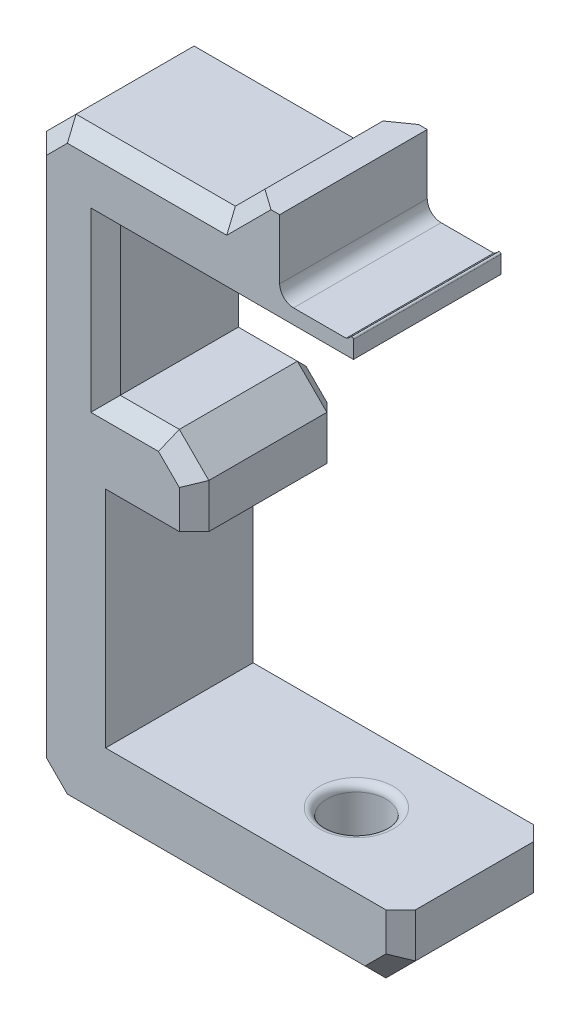
from build123d import *

# Parameters (mm, degrees)
RESSALTO_EXTRUS_O1_DEPTH = 10
ESBO_O3_R                = 2
CORTE_EXTRUS_O1_DEPTH    = 15
CHANFRO1_SIZE            = 1.6
FILETE1_R                = 0.5
FILETE2_R                = 0.94
RESSALTO_EXTRUS_O3_DEPTH = 10
CHANFRO5_SIZE            = 2
CHANFRO4_SIZE            = 1


with BuildPart() as part:
    # Esboço1 → Ressalto-extrusão1 (new body)
    with BuildSketch(Plane.XY):
        with BuildLine():
            Line((11, 14.25), (-5.8, 14.25))
            Line((-5.8, 14.25), (-5.8, 4.25))
            Line((-5.8, 4.25), (0.2, 4.25))
            Line((0.2, 4.25), (0.2, -0.75))
            Line((0.2, -0.75), (-5.8, -0.75))
            Line((-5.8, -0.75), (-5.8, -15.95))
            Line((-5.8, -15.95), (14.2, -15.95))
            Line((14.2, -15.95), (14.2, -20.95))
            Line((14.2, -20.95), (-10.8, -20.95))
            Line((-10.8, -20.95), (-10.8, 19.25))
            Line((-10.8, 19.25), (6, 19.25))
            Line((6, 19.25), (6, 16.25))
            Line((6, 16.25), (10.504380809, 16.25))
            ThreePointArc((10.504380809, 16.25), (10.676386068, 16.357306387), (10.826229508, 16.493861918))
            ThreePointArc((10.826229508, 16.493861918), (10.936214298, 16.519561844), (11, 16.426349589))
            Line((11, 16.426349589), (11, 16.25))
            Line((11, 16.25), (11, 14.25))
        make_face()
    extrude(amount=RESSALTO_EXTRUS_O1_DEPTH)

    # Esboço3 → Corte-extrusão1 (cut)
    with BuildSketch(Plane.XZ.offset(20.95)):
        with Locations(Location((6.2, 5, 0), (0, 0, 270))):
            Circle(ESBO_O3_R)
    extrude(amount=-CORTE_EXTRUS_O1_DEPTH, mode=Mode.SUBTRACT)

    # Chanfro1
    chanfro1_edges = [part.edges().sort_by_distance(p)[0] for p in [
        (6.2, -20.95, 7),
    ]]
    chamfer(chanfro1_edges, length=CHANFRO1_SIZE)

    # Filete1
    filete1_edges = [part.edges().sort_by_distance(p)[0] for p in [
        (6.2, -15.95, 7),
    ]]
    fillet(filete1_edges, radius=FILETE1_R)

    # Filete2
    filete2_edges = [part.edges().sort_by_distance(p)[0] for p in [
        (6, 16.25, 5),
    ]]
    fillet(filete2_edges, radius=FILETE2_R)

    # Esboço5 → Ressalto-extrusão3 (add)
    with BuildSketch(Plane.XY.offset(10)):
        Polygon((6, 19.25), (6, 21.25), (4, 21.25), (2, 19.25), align=None)
    extrude(amount=-RESSALTO_EXTRUS_O3_DEPTH)

    # Chanfro5
    chanfro5_edges = [part.edges().sort_by_distance(p)[0] for p in [
        (14.2, -20.95, 5),
        (-10.8, -20.95, 5),
        (-10.8, 19.25, 5),
        (0.2, 4.25, 5),
    ]]
    chamfer(chanfro5_edges, length=CHANFRO5_SIZE)

    # Chanfro4
    chanfro4_edges = [part.edges().sort_by_distance(p)[0] for p in [
        (-5.8, 9.25, 10),
        (2.6, 14.25, 10),
        (2.6, 14.25, 0),
        (-5.8, 9.25, 0),
        (0.2, 0.75, 0),
        (11, 14.25, 5),
        (0.2, 0.75, 10),
        (-3.4, 19.25, 0),
        (-3.4, 19.25, 10),
        (3, 20.25, 10),
        (3, 20.25, 0),
        (-3.8, 4.25, 0),
        (-3.8, 4.25, 10),
        (14.2, -17.45, 0),
        (1.7, -20.95, 0),
        (-10.8, -0.85, 0),
        (-9.8, 18.25, 0),
        (-9.8, -19.95, 0),
        (13.2, -19.95, 0),
        (-0.8, 3.25, 0),
        (-10.8, -0.85, 10),
        (1.7, -20.95, 10),
        (14.2, -17.45, 10),
        (-9.8, 18.25, 10),
        (-9.8, -19.95, 10),
        (13.2, -19.95, 10),
        (-0.8, 3.25, 10),
    ]]
    chamfer(chanfro4_edges, length=CHANFRO4_SIZE)


solid = part.part
